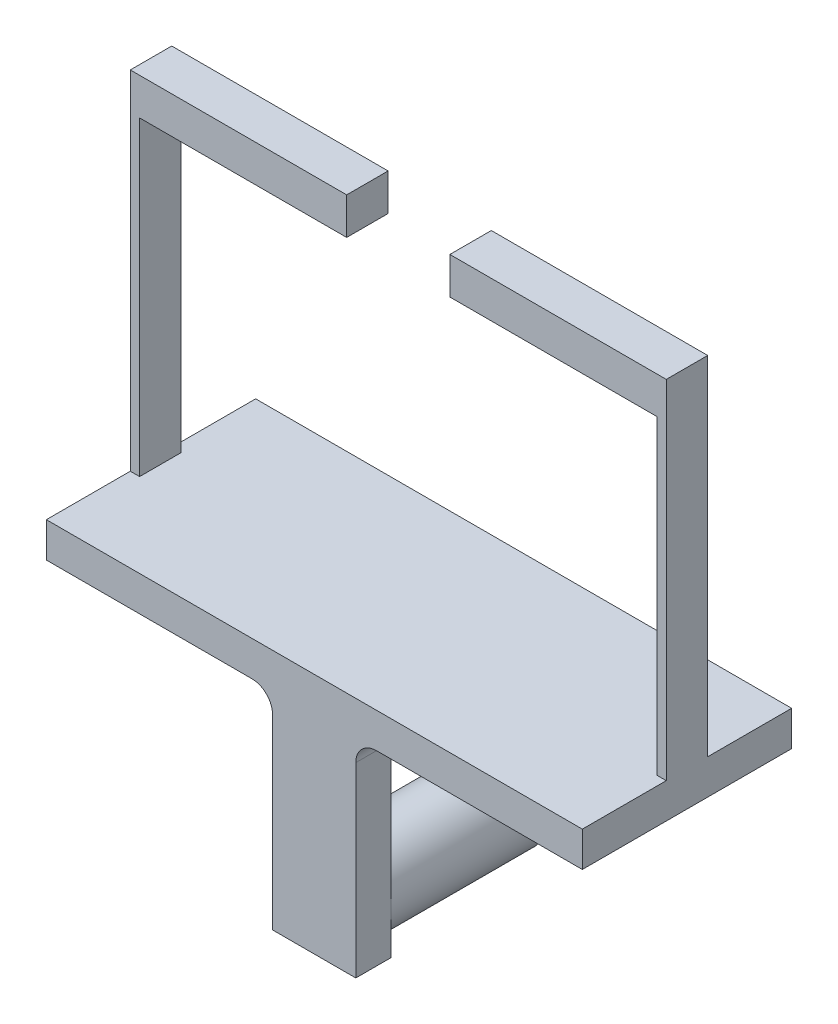
from build123d import *

# Parameters (mm, degrees)
SKETCH6_W            = 10.1981
SKETCH6_H            = 4.28752
BOSS_EXTRUDE3_DEPTH  = 25.4
SKETCH8_R            = 5.09905
BOSS_EXTRUDE5_DEPTH  = 19.05
SKETCH11_W           = 65.69456
SKETCH11_H           = 25.654
BOSS_EXTRUDE10_DEPTH = 4.28752
SKETCH16_W           = 1.143
SKETCH16_H           = 5.08
SKETCH16_W_2         = 1.155076163
BOSS_EXTRUDE11_DEPTH = 38.0746
SKETCH17_W           = 26.52268
SKETCH17_H           = 5.08
BOSS_EXTRUDE12_DEPTH = 4.5212
FILLET2_R            = 2.54
FILLET3_R            = 2.54
FILLET4_R            = 2.54


with BuildPart() as part:
    # Sketch6 → Boss-Extrude3 (new body)
    with BuildSketch(Plane(origin=(0, 0, 0), x_dir=(1, 0, 0), z_dir=(0, 1, 0))):
        with Locations((-12.169797761, 9.77580804)):
            Rectangle(SKETCH6_W, SKETCH6_H)
    extrude(amount=BOSS_EXTRUDE3_DEPTH)

    # Sketch8 → Boss-Extrude5 (add)
    with BuildSketch(Plane.XY.offset(-11.91956804)):
        with Locations((-12.169797761, 5.098542)):
            Circle(SKETCH8_R)
    extrude(amount=-BOSS_EXTRUDE5_DEPTH)

    # Sketch11 → Boss-Extrude10 (add)
    with BuildSketch(Plane(origin=(0, 25.4, 0), x_dir=(1, 0, 0), z_dir=(0, 1, 0))):
        with Locations((-12.150747761, 20.45904804)):
            Rectangle(SKETCH11_W, SKETCH11_H)
    extrude(amount=BOSS_EXTRUDE10_DEPTH)

    # Sketch16 → Boss-Extrude11 (add)
    with BuildSketch(Plane(origin=(0, 29.68752, 0), x_dir=(1, 0, 0), z_dir=(0, 1, 0))):
        with Locations((-44.426527761, 20.45904804)):
            Rectangle(SKETCH16_W, SKETCH16_H)
        with Locations((20.118994158, 20.45904804)):
            Rectangle(SKETCH16_W_2, SKETCH16_H)
    extrude(amount=BOSS_EXTRUDE11_DEPTH)

    # Sketch17 → Boss-Extrude12 (add)
    with BuildSketch(Plane(origin=(0, 67.76212, 0), x_dir=(1, 0, 0), z_dir=(0, 1, 0))):
        with Locations((-31.736687761, 20.45904804)):
            Rectangle(SKETCH17_W, SKETCH17_H)
        with Locations((7.435192239, 20.45904804)):
            Rectangle(SKETCH17_W, SKETCH17_H)
    extrude(amount=BOSS_EXTRUDE12_DEPTH)

    # Fillet2
    fillet2_edges = [part.edges().sort_by_distance(p)[0] for p in [
        (-12.169797761, 25.4, -11.91956804),
    ]]
    fillet(fillet2_edges, radius=FILLET2_R)

    # Fillet3
    fillet3_edges = [part.edges().sort_by_distance(p)[0] for p in [
        (-17.268847761, 25.4, -11.04580804),
    ]]
    fillet(fillet3_edges, radius=FILLET3_R)

    # Fillet4
    fillet4_edges = [part.edges().sort_by_distance(p)[0] for p in [
        (-7.070747761, 25.4, -11.04580804),
    ]]
    fillet(fillet4_edges, radius=FILLET4_R)


solid = part.part
